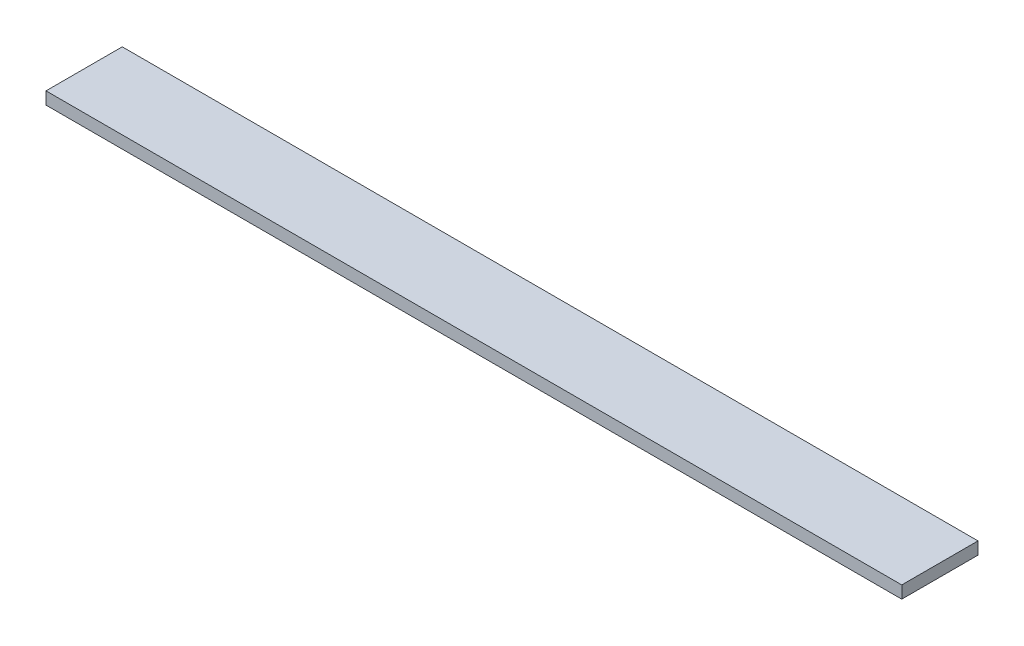
from build123d import *

# Parameters (mm, degrees)
SKETCH1_W           = 2636.8375
SKETCH1_H           = 234.95
BOSS_EXTRUDE1_DEPTH = 38.1


with BuildPart() as part:
    # Sketch1 → Boss-Extrude1 (new body)
    with BuildSketch(Plane(origin=(0, 0, 0), x_dir=(1, 0, 0), z_dir=(0, 1, 0))):
        with Locations((597.244836957, 304.583695652)):
            Rectangle(SKETCH1_W, SKETCH1_H)
    extrude(amount=BOSS_EXTRUDE1_DEPTH)


solid = part.part
